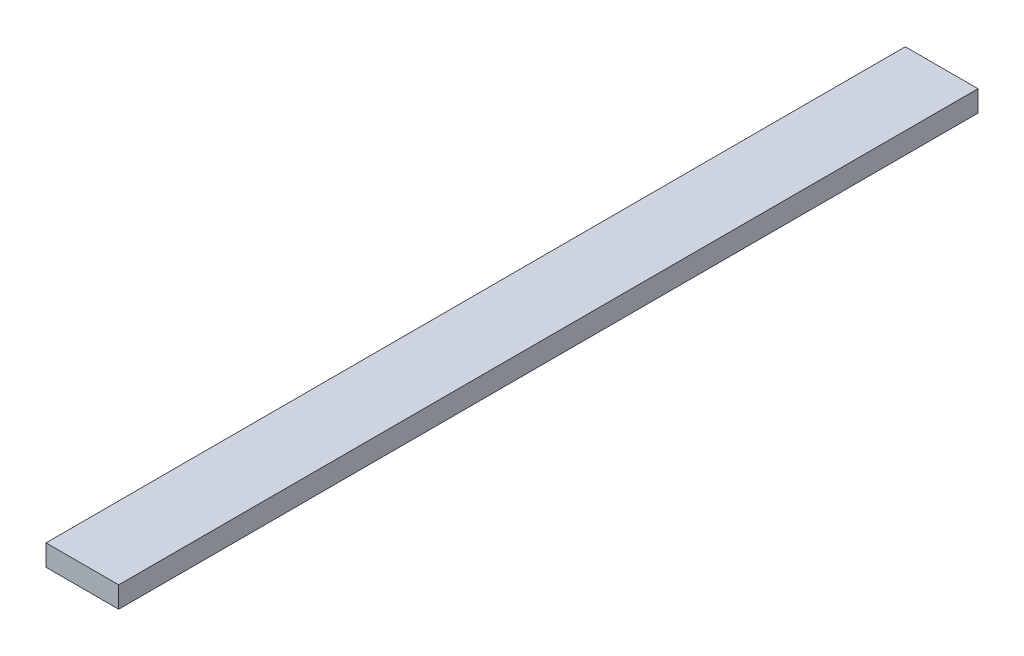
from build123d import *

# Parameters (mm, degrees)
SKETCH1_W           = 13.97
SKETCH1_H           = 165.1
BOSS_EXTRUDE1_DEPTH = 4.064


with BuildPart() as part:
    # Sketch1 → Boss-Extrude1 (new body)
    with BuildSketch(Plane(origin=(0, 0, 0), x_dir=(1, 0, 0), z_dir=(0, 1, 0))):
        with Locations((0.840787037, 62.759166667)):
            Rectangle(SKETCH1_W, SKETCH1_H)
    extrude(amount=BOSS_EXTRUDE1_DEPTH)


solid = part.part
